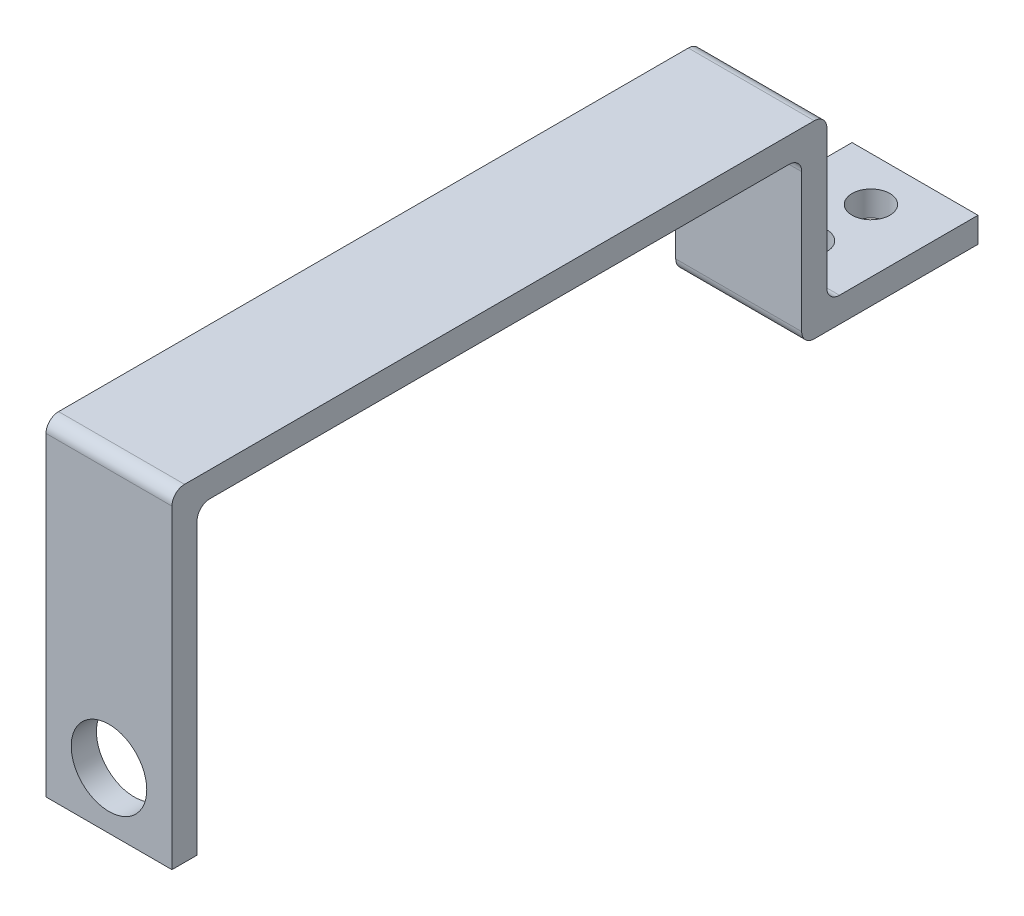
from build123d import *

# Parameters (mm, degrees)
SKETCH1_W           = 10
SKETCH1_H           = 12
SKETCH1_R           = 1.5
BOSS_EXTRUDE1_DEPTH = 2
SKETCH2_W           = 10
SKETCH2_H           = 13
BOSS_EXTRUDE2_DEPTH = 2
SKETCH3_W           = 10
SKETCH3_H           = 50
BOSS_EXTRUDE3_DEPTH = 2
SKETCH4_W           = 10
SKETCH4_H           = 26
SKETCH4_R           = 3
BOSS_EXTRUDE4_DEPTH = 2
FILLET1_R           = 1
FILLET2_R           = 1
FILLET3_R           = 1
FILLET4_R           = 1
FILLET5_R           = 1
FILLET6_R           = 1


with BuildPart() as part:
    # Sketch1 → Boss-Extrude1 (new body)
    with BuildSketch(Plane(origin=(0, 0, 0), x_dir=(1, 0, 0), z_dir=(0, 1, 0))):
        with Locations((-0.086956522, 1.043478261)):
            Rectangle(SKETCH1_W, SKETCH1_H)
        with Locations(Location((-0.086956522, -1.456521739, 0), (0, 0, 270))):
            Circle(SKETCH1_R, mode=Mode.SUBTRACT)
        with Locations(Location((-0.086956522, 3.543478261, 0), (0, 0, 270))):
            Circle(SKETCH1_R, mode=Mode.SUBTRACT)
    extrude(amount=BOSS_EXTRUDE1_DEPTH)

    # Sketch2 → Boss-Extrude2 (add)
    with BuildSketch(Plane.XY.offset(4.956521739)):
        with Locations((-0.086956522, 6.5)):
            Rectangle(SKETCH2_W, SKETCH2_H)
    extrude(amount=BOSS_EXTRUDE2_DEPTH)

    # Sketch3 → Boss-Extrude3 (add)
    with BuildSketch(Plane(origin=(0, 13, 0), x_dir=(1, 0, 0), z_dir=(0, 1, 0))):
        with Locations((-0.086956522, -29.956521739)):
            Rectangle(SKETCH3_W, SKETCH3_H)
    extrude(amount=BOSS_EXTRUDE3_DEPTH)

    # Sketch4 → Boss-Extrude4 (add)
    with BuildSketch(Plane.XY.offset(54.956521739)):
        with Locations((-0.086956522, 2)):
            Rectangle(SKETCH4_W, SKETCH4_H)
        with Locations((-0.086956522, -6.5)):
            Circle(SKETCH4_R, mode=Mode.SUBTRACT)
    extrude(amount=BOSS_EXTRUDE4_DEPTH)

    # Fillet1
    fillet1_edges = [part.edges().sort_by_distance(p)[0] for p in [
        (-0.086956522, 15, 56.956521739),
    ]]
    fillet(fillet1_edges, radius=FILLET1_R)

    # Fillet2
    fillet2_edges = [part.edges().sort_by_distance(p)[0] for p in [
        (-0.086956522, 13, 54.956521739),
    ]]
    fillet(fillet2_edges, radius=FILLET2_R)

    # Fillet3
    fillet3_edges = [part.edges().sort_by_distance(p)[0] for p in [
        (-0.086956522, 15, 4.956521739),
    ]]
    fillet(fillet3_edges, radius=FILLET3_R)

    # Fillet4
    fillet4_edges = [part.edges().sort_by_distance(p)[0] for p in [
        (-0.086956522, 13, 6.956521739),
    ]]
    fillet(fillet4_edges, radius=FILLET4_R)

    # Fillet5
    fillet5_edges = [part.edges().sort_by_distance(p)[0] for p in [
        (-0.086956522, 0, 6.956521739),
    ]]
    fillet(fillet5_edges, radius=FILLET5_R)

    # Fillet6
    fillet6_edges = [part.edges().sort_by_distance(p)[0] for p in [
        (-0.086956522, 2, 4.956521739),
    ]]
    fillet(fillet6_edges, radius=FILLET6_R)


solid = part.part
